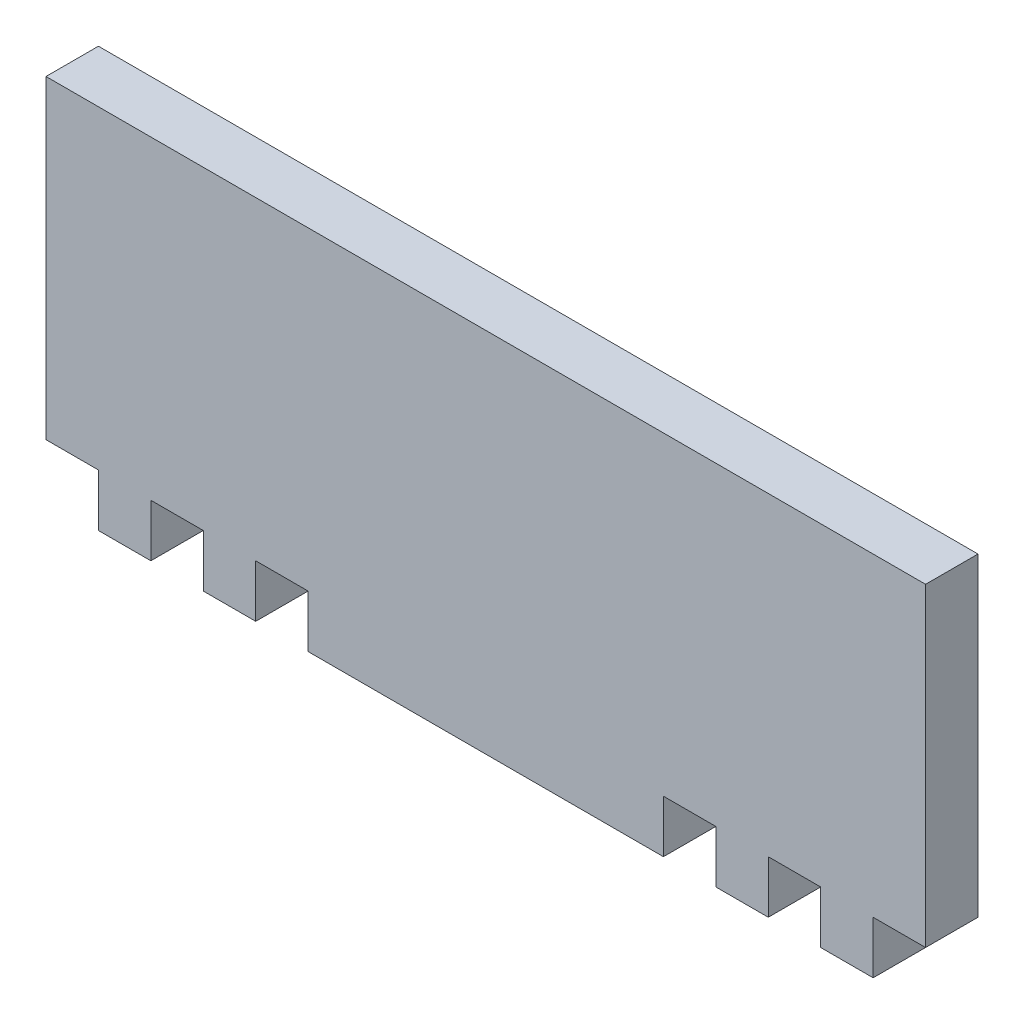
from build123d import *

# Parameters (mm, degrees)
BOSS_EXTRU_1_DEPTH = 5


with BuildPart() as part:
    # Esquisse1 → Boss.-Extru.1 (new body)
    with BuildSketch(Plane.XY):
        Polygon((-95.76574078, 49.22911508), (-90.76574078, 49.22911508), (-90.76574078, 44.22911508), (-85.76574078, 44.22911508), (-85.76574078, 49.22911508), (-80.76574078, 49.22911508), (-80.76574078, 44.22911508), (-75.76574078, 44.22911508), (-75.76574078, 49.22911508), (-70.76574078, 49.22911508), (-70.76574078, 44.22911508), (-36.884730398, 44.22911508), (-36.884730398, 49.22911508), (-31.884730398, 49.22911508), (-31.884730398, 44.22911508), (-26.884730398, 44.22911508), (-26.884730398, 49.22911508), (-21.884730398, 49.22911508), (-21.884730398, 44.22911508), (-16.884730398, 44.22911508), (-16.884730398, 49.22911508), (-11.884730398, 49.22911508), (-11.884730398, 79.22911508), (-95.76574078, 79.22911508), align=None)
    extrude(amount=BOSS_EXTRU_1_DEPTH)


solid = part.part
